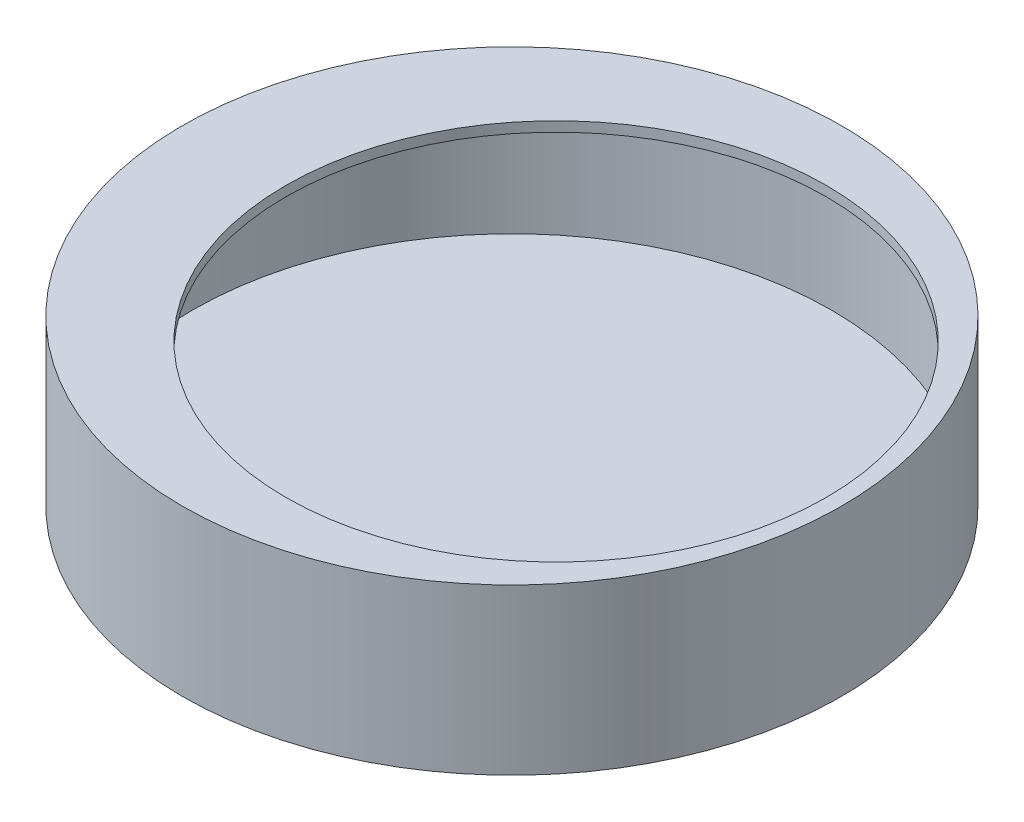
from build123d import *

# Parameters (mm, degrees)
SKETCH_3_R          = 41
CUT_EXTRUDE_2_DEPTH = 6


with BuildPart() as part:
    # 草图2 → 旋转-薄壁6 (revolve)
    with BuildSketch(Plane.XY, mode=Mode.PRIVATE) as revolve_6_sk:
        Polygon((0, 5.723684211), (50, 5.723684211), (50, -19.276315789), (0, -19.276315789), (0, -17.776315789), (48.5, -17.776315789), (48.5, 4.223684211), (0, 4.223684211), align=None)
    revolve(revolve_6_sk.sketch.rotate(Axis((0, 38.419124221, 0), (0, -1, 0)), 90), axis=Axis((0, 38.419124221, 0), (0, -1, 0)))

    # 草图3 → 切除-拉伸2 (cut, symmetric)
    with BuildSketch(Plane(origin=(0, 0, 0), x_dir=(1, 0, 0), z_dir=(0, 1, 0))):
        with Locations(Location((6.69886917, 0, 0), (0, 0, 270))):
            Circle(SKETCH_3_R)
    extrude(amount=CUT_EXTRUDE_2_DEPTH, both=True, mode=Mode.SUBTRACT)


solid = part.part
